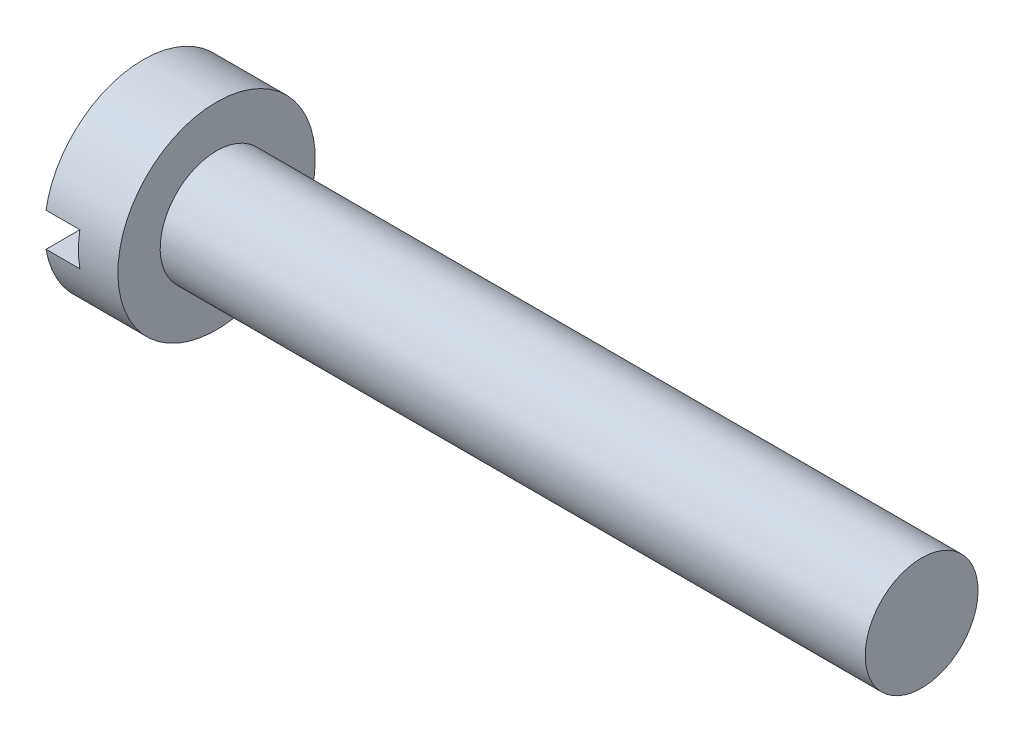
from build123d import *

# Parameters (mm, degrees)
SKETCH2_W          = 7
SKETCH2_H          = 1.2
CUT_EXTRUDE1_DEPTH = 1.2


with BuildPart() as part:
    # Sketch1 → Revolve1 (revolve)
    with BuildSketch(Plane.XY):
        Polygon((0, 0), (0, 3.5), (2.6, 3.5), (2.6, 2), (27.6, 2), (27.6, 0), align=None)
    revolve(axis=Axis((27.6, 0, 0), (-1, 0, 0)))

    # Sketch2 → Cut-Extrude1 (cut)
    with BuildSketch(Plane.ZY):
        Rectangle(SKETCH2_W, SKETCH2_H)
    extrude(amount=-CUT_EXTRUDE1_DEPTH, mode=Mode.SUBTRACT)


solid = part.part
